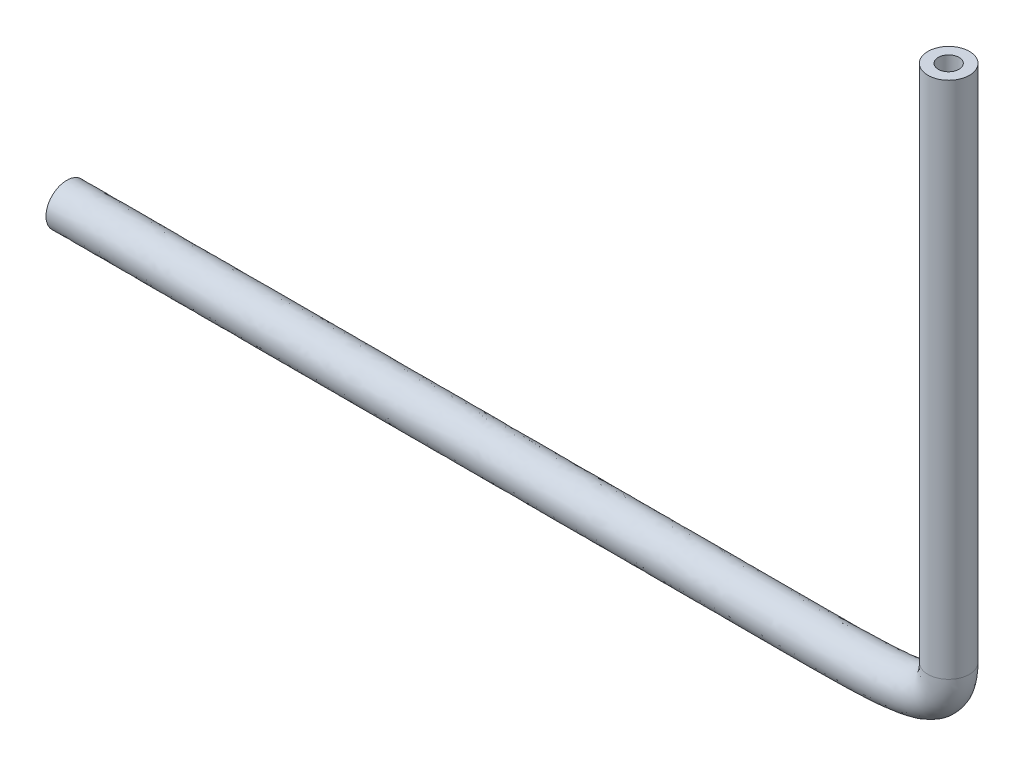
from build123d import *

# Parameters (mm, degrees)
PIPERING_R   = 0.8
PIPERING_R_2 = 0.4


with BuildPart() as part:
    # Pipe: sweep along a path in PipeSke
    with BuildLine() as pipe_path:  # in the path sketch's own coordinates; laid on its plane below (add() does not lay a ready-made edge on the line's plane)
        Line((-28, 0), (0, 0))
        add(Edge.make_bspline(
            [(0, 0), (4.619948081, 0), (6, 0.035966381), (6, 1.704499781)],
            knots=[0, 0, 0, 0, 1, 1, 1, 1], degree=3))
        Line((6, 1.704499781), (6, 21.704499781))
    # PipeRing → Pipe (sweep)
    with BuildSketch(Plane(origin=(0, 0, 0), x_dir=(0, 0, -1), z_dir=(1, 0, 0))):
        Circle(PIPERING_R)
        Circle(PIPERING_R_2, mode=Mode.SUBTRACT)
    sweep(path=Plane.XY * pipe_path.line)


solid = part.part
